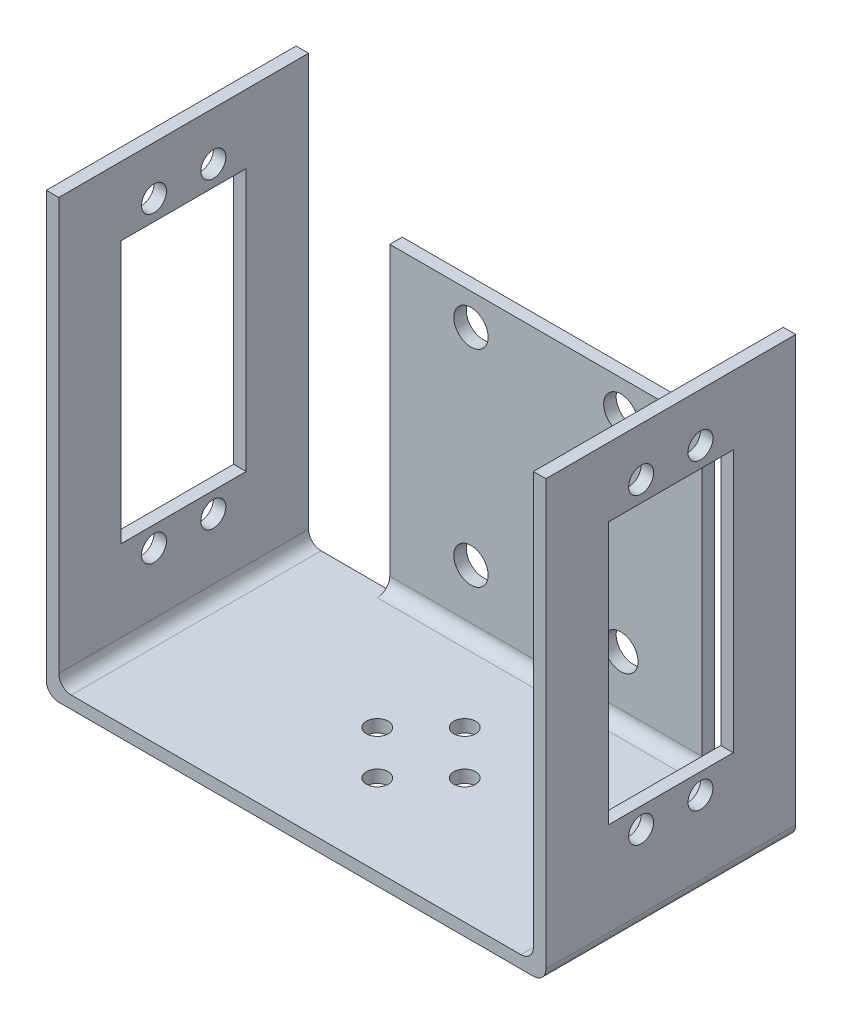
from build123d import *

# Parameters (mm, degrees)
EXTRUDE_1_DEPTH     = 20
SKETCH_2_R          = 1.75
CUT_EXTRUDE_1_DEPTH = 10
SKETCH_3_W          = 20
SKETCH_3_H          = 42
CUT_EXTRUDE_2_DEPTH = 107.883113727
SKETCH_4_R          = 2
CUT_EXTRUDE_3_DEPTH = 107.883113727
SKETCH_8_W          = 2
SKETCH_8_H          = 50
EXTRUDE_4_DEPTH     = 25
SKETCH_9_R          = 2.75
CUT_EXTRUDE_4_DEPTH = 8
FILLET_1_R          = 2


with BuildPart() as part:
    # 草图1 → 凸台-拉伸1 (new, symmetric)
    with BuildSketch(Plane.XY):
        Polygon((-38, 0), (38, 0), (38, 68), (40, 68), (40, -2), (-40, -2), (-40, 68), (-38, 68), align=None)
    extrude(amount=EXTRUDE_1_DEPTH, both=True)

    # 草图2 → 切除-拉伸1 (cut)
    with BuildSketch(Plane(origin=(0, 0, 0), x_dir=(1, 0, 0), z_dir=(0, 1, 0))):
        with Locations(Location((0, 7, 0), (0, 0, 270))):
            Circle(SKETCH_2_R)
        with Locations(Location((-7, 0, 0), (0, 0, 270))):
            Circle(SKETCH_2_R)
        with Locations(Location((0, -7, 0), (0, 0, 270))):
            Circle(SKETCH_2_R)
        with Locations(Location((7, 0, 0), (0, 0, 270))):
            Circle(SKETCH_2_R)
    extrude(amount=-CUT_EXTRUDE_1_DEPTH, mode=Mode.SUBTRACT)

    # 草图3 → 切除-拉伸2 (cut, through all)
    with BuildSketch(Plane(origin=(40, 0, 0), x_dir=(0, 0, -1), z_dir=(1, 0, 0))):
        with Locations((0, 36)):
            Rectangle(SKETCH_3_W, SKETCH_3_H)
    extrude(amount=-CUT_EXTRUDE_2_DEPTH, mode=Mode.SUBTRACT)

    # 草图4 → 切除-拉伸3 (cut, through all)
    with BuildSketch(Plane(origin=(40, 0, 0), x_dir=(0, 0, -1), z_dir=(1, 0, 0))):
        with Locations((-4.75, 60.25)):
            Circle(SKETCH_4_R)
        with Locations((4.75, 60.25)):
            Circle(SKETCH_4_R)
        with Locations((-4.75, 11.75)):
            Circle(SKETCH_4_R)
        with Locations((4.75, 11.75)):
            Circle(SKETCH_4_R)
    extrude(amount=-CUT_EXTRUDE_3_DEPTH, mode=Mode.SUBTRACT)

    # 草图8 → 凸台-拉伸4 (add, symmetric)
    with BuildSketch(Plane(origin=(0, 0, 0), x_dir=(0, 0, -1), z_dir=(1, 0, 0))):
        with Locations((21, 23)):
            Rectangle(SKETCH_8_W, SKETCH_8_H)
    extrude(amount=EXTRUDE_4_DEPTH, both=True)

    # 草图9 → 切除-拉伸4 (cut)
    with BuildSketch(Plane.XY.offset(-20)):
        with Locations((12, 10)):
            Circle(SKETCH_9_R)
        with Locations((12, 43)):
            Circle(SKETCH_9_R)
    cut_extrude_4 = extrude(amount=-CUT_EXTRUDE_4_DEPTH, mode=Mode.SUBTRACT)

    # 镜向1: 切除-拉伸4 across plane
    add(cut_extrude_4.mirror(Plane(origin=(0, 0, 0), x_dir=(0, 0, 1), z_dir=(1, 0, 0))), mode=Mode.SUBTRACT)

    # 圆角1
    fillet_1_edges = [part.edges().sort_by_distance(p)[0] for p in [
        (0, -2, -22),
        (0, 0, -20),
        (-38, 0, 0),
        (-40, -2, 0),
        (40, -2, 0),
        (38, 0, 0),
    ]]
    fillet(fillet_1_edges, radius=FILLET_1_R)


solid = part.part
